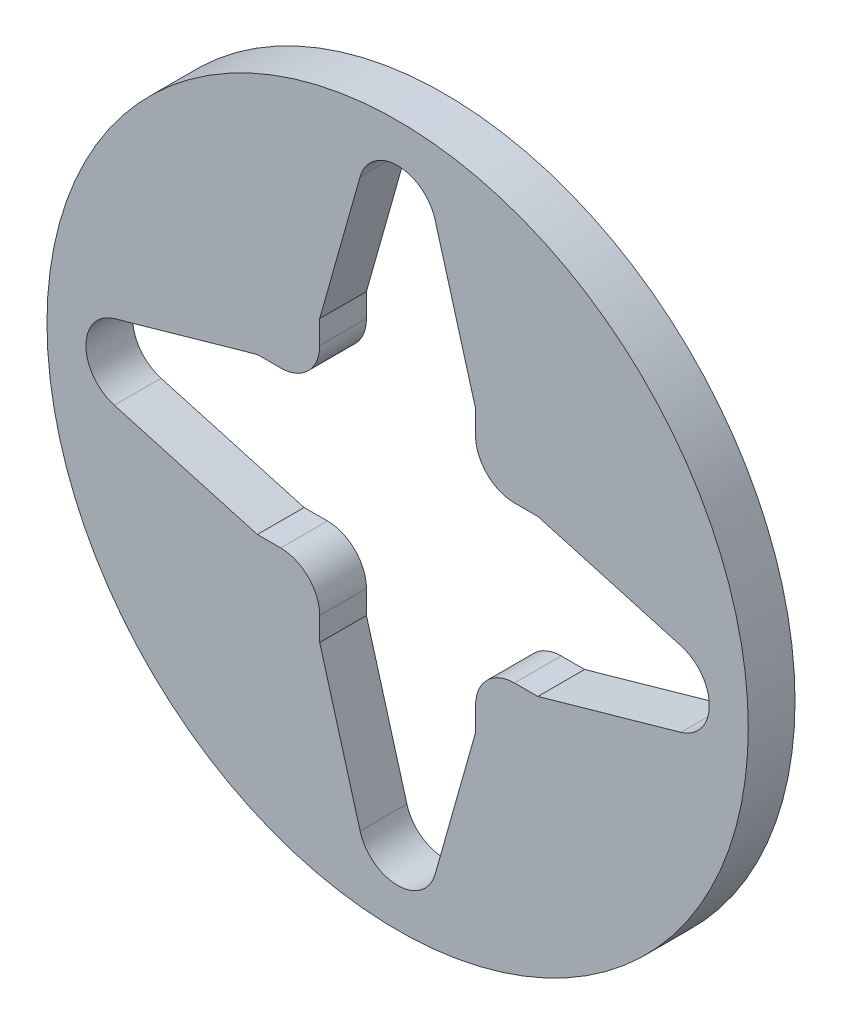
from build123d import *

# Parameters (mm, degrees)
SKETCH1_R           = 2.5
SKETCH1_W           = 57
SKETCH1_H           = 22.5
BOSS_EXTRUDE1_DEPTH = 3
CUT_EXTRUDE1_DEPTH  = 83.677082677


with BuildPart() as part:
    # Sketch1 → Boss-Extrude1 (new body)
    # profile 1 of 8: a face of its own
    with BuildSketch(Plane.XY):
        with BuildLine():
            ThreePointArc((22.5, 0), (15.909902577, 15.909902577), (0, 22.5))
            Line((0, 22.5), (-22.5, 0))
            Line((-22.5, 0), (-22.124973736, -4.090909091))
            ThreePointArc((-22.124973736, -4.090909091), (2.054031517, -22.406047276), (22.5, 0))
        make_face()
        with BuildLine():
            ThreePointArc((-7.5, 5), (-9.267766953, 9.267766953), (-5, 7.5))
            Line((-5, 7.5), (-5, 9))
            Line((-5, 9), (-2.405779746, 18.179870439))
            ThreePointArc((-2.405779746, 18.179870439), (0, 20), (2.405779746, 18.179870439))
            Line((2.405779746, 18.179870439), (5, 9))
            Line((5, 9), (5, 7.5))
            ThreePointArc((5, 7.5), (7.5, 10), (10, 7.5))
            ThreePointArc((10, 7.5), (9.267766953, 5.732233047), (7.5, 5))
            Line((7.5, 5), (9, 5))
            Line((9, 5), (18.179870439, 2.405779746))
            ThreePointArc((18.179870439, 2.405779746), (19.493699588, 1.508363998), (20, 0))
            ThreePointArc((20, 0), (19.493699588, -1.508363998), (18.179870439, -2.405779746))
            Line((18.179870439, -2.405779746), (9, -5))
            Line((9, -5), (7.5, -5))
            ThreePointArc((7.5, -5), (9.267766953, -5.732233047), (10, -7.5))
            ThreePointArc((10, -7.5), (7.5, -10), (5, -7.5))
            Line((5, -7.5), (5, -9))
            Line((5, -9), (2.405779746, -18.179870439))
            ThreePointArc((2.405779746, -18.179870439), (0, -20), (-2.405779746, -18.179870439))
            Line((-2.405779746, -18.179870439), (-5, -9))
            Line((-5, -9), (-5, -7.5))
            ThreePointArc((-5, -7.5), (-9.267766953, -9.267766953), (-7.5, -5))
            Line((-7.5, -5), (-9, -5))
            Line((-9, -5), (-18.179870439, -2.405779746))
            ThreePointArc((-18.179870439, -2.405779746), (-20, 0), (-18.179870439, 2.405779746))
            Line((-18.179870439, 2.405779746), (-9, 5))
            Line((-9, 5), (-7.5, 5))
        make_face(mode=Mode.SUBTRACT)
    # profile 2 of 8: a face of its own
    with BuildSketch(Plane.XY):
        with Locations((-7.5, 7.5)):
            Circle(SKETCH1_R)
    # profile 3 of 8: a face of its own
    with BuildSketch(Plane.XY):
        with Locations((7.5, 7.5)):
            Circle(SKETCH1_R)
    # profile 4 of 8: a face of its own
    with BuildSketch(Plane.XY):
        with Locations((7.5, -7.5)):
            Circle(SKETCH1_R)
    # profile 5 of 8: a face of its own
    with BuildSketch(Plane.XY):
        with Locations((-7.5, -7.5)):
            Circle(SKETCH1_R)
    # profile 6 of 8: a face of its own
    with BuildSketch(Plane.XY):
        Polygon((-22.5, 22.5), (0, 22.5), (-22.5, 0), align=None)
    # profile 7 of 8: a face of its own
    with BuildSketch(Plane.XY):
        with Locations((-51, 11.25)):
            Rectangle(SKETCH1_W, SKETCH1_H)
    # profile 8 of 8: a face of its own
    with BuildSketch(Plane.XY):
        with BuildLine():
            Line((-22.5, 0), (-22.124973736, -4.090909091))
            ThreePointArc((-22.124973736, -4.090909091), (-23.843623821, -1.156469426), (-27.041634566, 0))
            Line((-27.041634566, 0), (-22.5, 0))
        make_face()
    extrude(amount=BOSS_EXTRUDE1_DEPTH)

    # Sketch4 → Cut-Extrude1 (cut, through all)
    with BuildSketch(Plane.XY.offset(3)):
        with BuildLine():
            Line((-79.5, 22.5), (0, 22.5))
            ThreePointArc((0, 22.5), (-17.295887583, 14.391048354), (-22.124973736, -4.090909091))
            ThreePointArc((-22.124973736, -4.090909091), (-23.843623821, -1.156469426), (-27.041634566, 0))
            Line((-27.041634566, 0), (-79.5, 0))
            Line((-79.5, 0), (-79.5, 22.5))
        make_face()
    extrude(amount=-CUT_EXTRUDE1_DEPTH, mode=Mode.SUBTRACT)


solid = part.part
